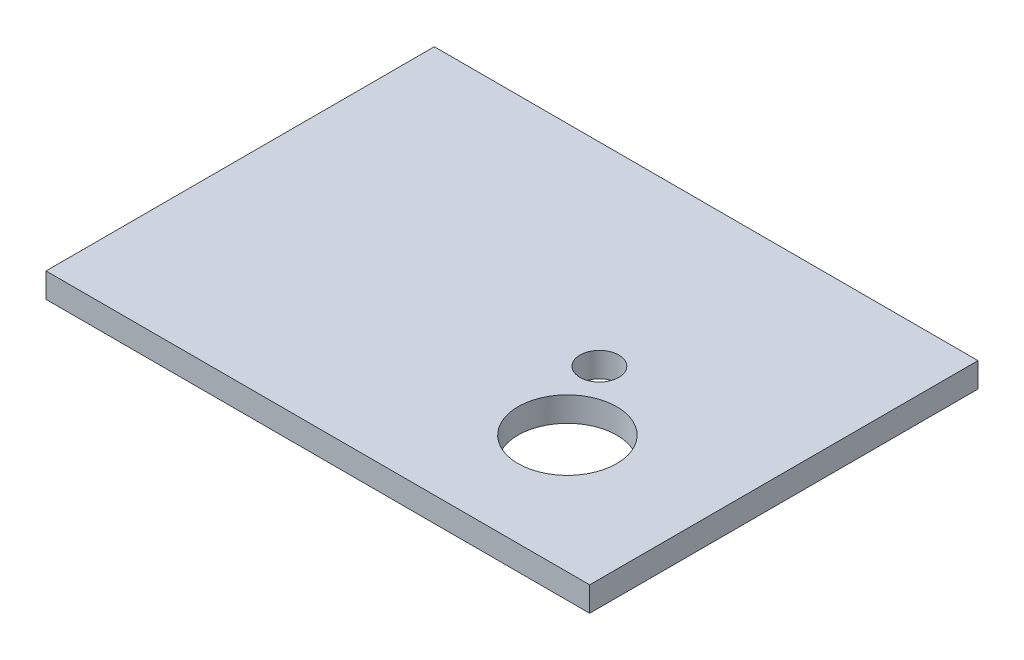
from build123d import *

# Parameters (mm, degrees)
SKETCH1_W           = 140
SKETCH1_H           = 100
BOSS_EXTRUDE1_DEPTH = 6.35
SKETCH2_R           = 12.705
SKETCH2_R_2         = 5
CUT_EXTRUDE1_DEPTH  = 10


with BuildPart() as part:
    # Sketch1 → Boss-Extrude1 (new body)
    with BuildSketch(Plane(origin=(0, 0, 0), x_dir=(1, 0, 0), z_dir=(0, 1, 0))):
        with Locations((70, 50)):
            Rectangle(SKETCH1_W, SKETCH1_H)
    extrude(amount=BOSS_EXTRUDE1_DEPTH)

    # Sketch2 → Cut-Extrude1 (cut)
    with BuildSketch(Plane(origin=(0, 6.35, 0), x_dir=(1, 0, 0), z_dir=(0, 1, 0))):
        with Locations(Location((103.75, 30.514428415, 0), (0, 0, 270))):
            Circle(SKETCH2_R)
        with Locations(Location((92.5, 50, 0), (0, 0, 270))):
            Circle(SKETCH2_R_2)
    extrude(amount=-CUT_EXTRUDE1_DEPTH, mode=Mode.SUBTRACT)


solid = part.part
